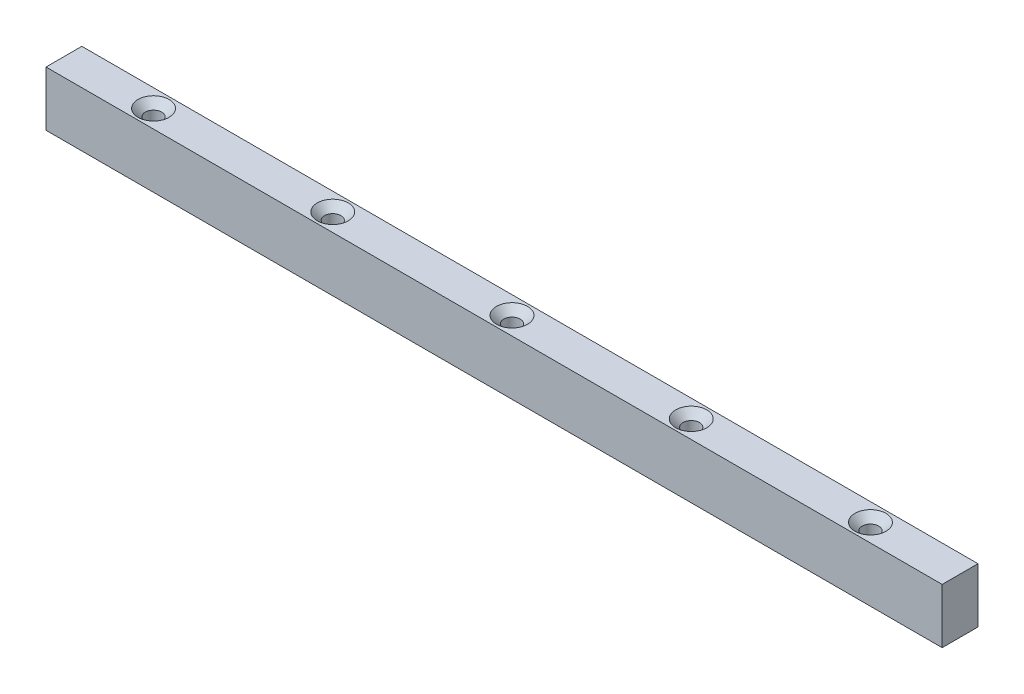
from build123d import *

# Parameters (mm, degrees)
SKETCH_1_W                 = 300
SKETCH_1_H                 = 12
EXTRUDE_268_DEPTH          = 18.35
HOLE_WIZARD_M4_D           = 5.5
HOLE_WIZARD_M4_CSINK_D     = 10.4
HOLE_WIZARD_M4_CSINK_ANGLE = 90
PATTERN_LINEAR_1_COUNT     = 3
PATTERN_LINEAR_1_PITCH     = 60
PATTERN_LINEAR_1_COL_COUNT = 3
PATTERN_LINEAR_1_COL_PITCH = 60
SKETCH_5_R                 = 3
CUT_EXTRUDE_6_DEPTH        = 11


with BuildPart() as part:
    # Эскиз1 → Extrude 268 (new body)
    with BuildSketch(Plane(origin=(0, 0, 0), x_dir=(1, 0, 0), z_dir=(0, 1, 0))):
        with Locations((0, 6)):
            Rectangle(SKETCH_1_W, SKETCH_1_H)
    extrude(amount=EXTRUDE_268_DEPTH)

    # Крепление-M4 (through all)
    with Locations(Plane(origin=(0, 18.35, 0), x_dir=(-1, 0, 0), z_dir=(0, 1, 0))):
        with Locations((0, -6)):
            hole_wizard_m4 = CounterSinkHole(HOLE_WIZARD_M4_D / 2, HOLE_WIZARD_M4_CSINK_D / 2, counter_sink_angle=HOLE_WIZARD_M4_CSINK_ANGLE)

    # Линейный массив1: Крепление-M4 ×3
    with Locations(*[(-i * PATTERN_LINEAR_1_PITCH, 0, 0) for i in range(1, PATTERN_LINEAR_1_COUNT)]):
        add(hole_wizard_m4, mode=Mode.SUBTRACT)

    # Линейный массив1 col: Крепление-M4 ×3
    with Locations(*[(i * PATTERN_LINEAR_1_COL_PITCH, 0, 0) for i in range(1, PATTERN_LINEAR_1_COL_COUNT)]):
        add(hole_wizard_m4, mode=Mode.SUBTRACT)

    # Эскиз5 → Валы-6мм (cut)
    with BuildSketch(Plane.XY.offset(-12)):
        with Locations((-144, 9.175)):
            Circle(SKETCH_5_R)
        with Locations((144, 9.175)):
            Circle(SKETCH_5_R)
    extrude(amount=CUT_EXTRUDE_6_DEPTH, mode=Mode.SUBTRACT)


solid = part.part
